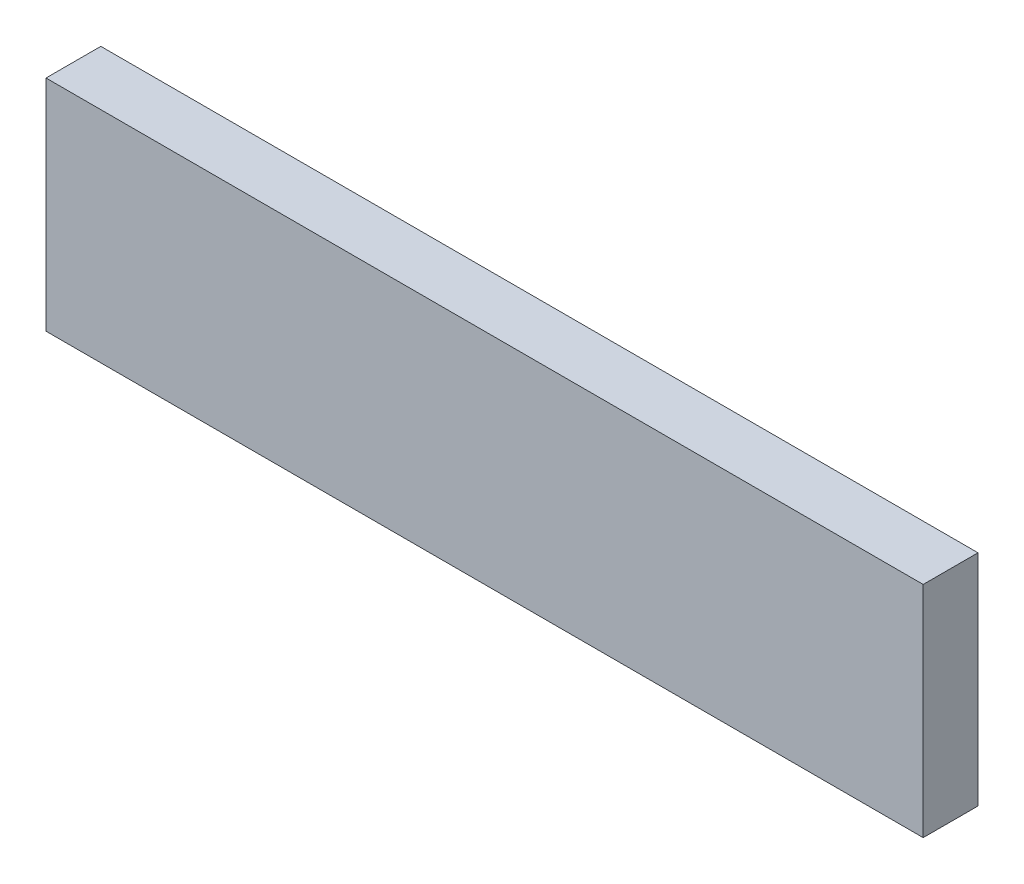
from build123d import *

# Parameters (mm, degrees)
SKETCH1_W           = 101.6
SKETCH1_H           = 25.4
BOSS_EXTRUDE1_DEPTH = 6.35


with BuildPart() as part:
    # Sketch1 → Boss-Extrude1 (new body)
    with BuildSketch(Plane.XY):
        Rectangle(SKETCH1_W, SKETCH1_H)
    extrude(amount=BOSS_EXTRUDE1_DEPTH)


solid = part.part
